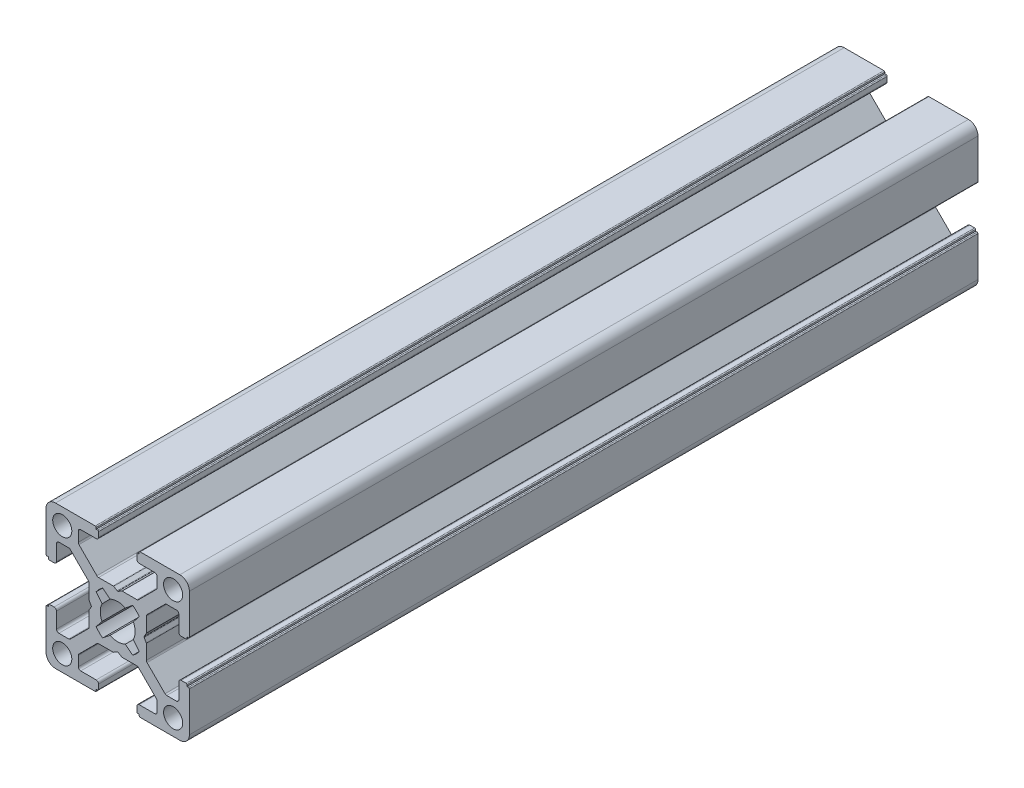
from build123d import *

# Parameters (mm, degrees)
CROQUIS1_R              = 2
SALIENTE_EXTRUIR1_DEPTH = 165


with BuildPart() as part:
    # Croquis1 → Saliente-Extruir1 (new body)
    with BuildSketch(Plane.XY.offset(1000)):
        with BuildLine():
            Line((9.800000436, -10.500000436), (10.100000436, -10.500000436))
            ThreePointArc((10.100000436, -10.500000436), (10.241421792, -10.441421792), (10.300000436, -10.300000436))
            Line((10.300000436, -10.300000436), (10.300000436, -2))
            ThreePointArc((10.300000436, -2), (9.714213998, -0.585786438), (8.300000436, 0))
            Line((8.300000436, 0), (0, 0))
            ThreePointArc((0, 0), (-0.141421356, -0.058578644), (-0.2, -0.2))
            Line((-0.2, -0.2), (-0.2, -0.5))
            Line((-0.2, -0.5), (-0.49999919, -0.5))
            ThreePointArc((-0.49999919, -0.5), (-0.641420811, -0.558578753), (-0.699999564, -0.700000374))
            Line((-0.699999564, -0.700000374), (-0.699999564, -1.700000763))
            ThreePointArc((-0.699999564, -1.700000763), (-0.553552955, -2.053554154), (-0.199999564, -2.200000763))
            Line((-0.199999564, -2.200000763), (3.050000763, -2.200000763))
            ThreePointArc((3.050000763, -2.200000763), (3.403554154, -2.346447372), (3.550000763, -2.700000763))
            Line((3.550000763, -2.700000763), (3.550000763, -4.743055509))
            ThreePointArc((3.550000763, -4.743055509), (3.511993279, -4.934269826), (3.403749103, -5.096413843))
            Line((3.403749103, -5.096413843), (-0.349053376, -8.853358334))
            ThreePointArc((-0.349053376, -8.853358334), (-0.511332616, -8.961886981), (-0.702801716, -9))
            Line((-0.702801716, -9), (-3.746809419, -9))
            ThreePointArc((-3.746809419, -9), (-3.798212795, -9.006718618), (-3.846162576, -9.026423071))
            Line((-3.846162576, -9.026423071), (-4.600646407, -9.458279719))
            ThreePointArc((-4.600646407, -9.458279719), (-4.699999564, -9.48470279), (-4.799352721, -9.458279719))
            Line((-4.799352721, -9.458279719), (-5.553836552, -9.026423071))
            ThreePointArc((-5.553836552, -9.026423071), (-5.601786333, -9.006718618), (-5.653189709, -9))
            Line((-5.653189709, -9), (-8.697197412, -9))
            ThreePointArc((-8.697197412, -9), (-8.888666513, -8.961886981), (-9.050945752, -8.853358334))
            Line((-9.050945752, -8.853358334), (-12.803748231, -5.096413843))
            ThreePointArc((-12.803748231, -5.096413843), (-12.911992407, -4.934269826), (-12.949999891, -4.743055509))
            Line((-12.949999891, -4.743055509), (-12.949999891, -2.700000763))
            ThreePointArc((-12.949999891, -2.700000763), (-12.803553282, -2.346447372), (-12.449999891, -2.200000763))
            Line((-12.449999891, -2.200000763), (-9.199999564, -2.200000763))
            ThreePointArc((-9.199999564, -2.200000763), (-8.846446173, -2.053554154), (-8.699999564, -1.700000763))
            Line((-8.699999564, -1.700000763), (-8.699999564, -0.700000374))
            ThreePointArc((-8.699999564, -0.700000374), (-8.758578317, -0.558578753), (-8.899999938, -0.5))
            Line((-8.899999938, -0.5), (-9.199999128, -0.5))
            Line((-9.199999128, -0.5), (-9.199999128, -0.2))
            ThreePointArc((-9.199999128, -0.2), (-9.258577772, -0.058578644), (-9.399999128, 0))
            Line((-9.399999128, 0), (-17.699999564, 0))
            ThreePointArc((-17.699999564, 0), (-19.114213126, -0.585786438), (-19.699999564, -2))
            Line((-19.699999564, -2), (-19.699999564, -10.300000436))
            ThreePointArc((-19.699999564, -10.300000436), (-19.64142092, -10.441421792), (-19.499999564, -10.500000436))
            Line((-19.499999564, -10.500000436), (-19.199999564, -10.500000436))
            Line((-19.199999564, -10.500000436), (-19.199999564, -10.799999627))
            ThreePointArc((-19.199999564, -10.799999627), (-19.141420811, -10.941421247), (-18.99999919, -11))
            Line((-18.99999919, -11), (-17.999998801, -11))
            ThreePointArc((-17.999998801, -11), (-17.64644541, -10.853553391), (-17.499998801, -10.5))
            Line((-17.499998801, -10.5), (-17.499998801, -7.249999673))
            ThreePointArc((-17.499998801, -7.249999673), (-17.353552192, -6.896446283), (-16.999998801, -6.749999673))
            Line((-16.999998801, -6.749999673), (-14.956944055, -6.749999673))
            ThreePointArc((-14.956944055, -6.749999673), (-14.765729738, -6.788007157), (-14.603585721, -6.896251334))
            Line((-14.603585721, -6.896251334), (-10.84664123, -10.649053813))
            ThreePointArc((-10.84664123, -10.649053813), (-10.738112583, -10.811333052), (-10.699999564, -11.002802152))
            Line((-10.699999564, -11.002802152), (-10.699999564, -14.046809855))
            ThreePointArc((-10.699999564, -14.046809855), (-10.693280947, -14.098213232), (-10.673576493, -14.146163012))
            Line((-10.673576493, -14.146163012), (-10.241719845, -14.900646843))
            ThreePointArc((-10.241719845, -14.900646843), (-10.215296774, -15), (-10.241719845, -15.099353157))
            Line((-10.241719845, -15.099353157), (-10.673576493, -15.853836988))
            ThreePointArc((-10.673576493, -15.853836988), (-10.693280947, -15.901786769), (-10.699999564, -15.953190146))
            Line((-10.699999564, -15.953190146), (-10.699999564, -18.997197848))
            ThreePointArc((-10.699999564, -18.997197848), (-10.738112583, -19.188666949), (-10.84664123, -19.350946188))
            Line((-10.84664123, -19.350946188), (-14.603585721, -23.103748667))
            ThreePointArc((-14.603585721, -23.103748667), (-14.765729738, -23.211992843), (-14.956944055, -23.250000327))
            Line((-14.956944055, -23.250000327), (-16.999998801, -23.250000327))
            ThreePointArc((-16.999998801, -23.250000327), (-17.353552192, -23.103553718), (-17.499998801, -22.750000327))
            Line((-17.499998801, -22.750000327), (-17.499998801, -19.5))
            ThreePointArc((-17.499998801, -19.5), (-17.64644541, -19.14644661), (-17.999998801, -19))
            Line((-17.999998801, -19), (-18.99999919, -19))
            ThreePointArc((-18.99999919, -19), (-19.141420811, -19.058578753), (-19.199999564, -19.200000374))
            Line((-19.199999564, -19.200000374), (-19.199999564, -19.499999564))
            Line((-19.199999564, -19.499999564), (-19.499999564, -19.499999564))
            ThreePointArc((-19.499999564, -19.499999564), (-19.64142092, -19.558578208), (-19.699999564, -19.699999564))
            Line((-19.699999564, -19.699999564), (-19.699999564, -28))
            ThreePointArc((-19.699999564, -28), (-19.114213126, -29.414213563), (-17.699999564, -30))
            Line((-17.699999564, -30), (-9.399999128, -30))
            ThreePointArc((-9.399999128, -30), (-9.258577772, -29.941421356), (-9.199999128, -29.8))
            Line((-9.199999128, -29.8), (-9.199999128, -29.5))
            Line((-9.199999128, -29.5), (-8.899999938, -29.5))
            ThreePointArc((-8.899999938, -29.5), (-8.758578317, -29.441421247), (-8.699999564, -29.299999627))
            Line((-8.699999564, -29.299999627), (-8.699999564, -28.299999237))
            ThreePointArc((-8.699999564, -28.299999237), (-8.846446173, -27.946445847), (-9.199999564, -27.799999237))
            Line((-9.199999564, -27.799999237), (-12.449999891, -27.799999237))
            ThreePointArc((-12.449999891, -27.799999237), (-12.803553282, -27.653552628), (-12.949999891, -27.299999237))
            Line((-12.949999891, -27.299999237), (-12.949999891, -25.256944491))
            ThreePointArc((-12.949999891, -25.256944491), (-12.911992407, -25.065730174), (-12.803748231, -24.903586157))
            Line((-12.803748231, -24.903586157), (-9.050945752, -21.146641666))
            ThreePointArc((-9.050945752, -21.146641666), (-8.888666513, -21.038113019), (-8.697197412, -21))
            Line((-8.697197412, -21), (-5.653189709, -21))
            ThreePointArc((-5.653189709, -21), (-5.601786333, -20.993281383), (-5.553836552, -20.973576929))
            Line((-5.553836552, -20.973576929), (-4.799352721, -20.541720281))
            ThreePointArc((-4.799352721, -20.541720281), (-4.699999564, -20.51529721), (-4.600646407, -20.541720281))
            Line((-4.600646407, -20.541720281), (-3.846162576, -20.973576929))
            ThreePointArc((-3.846162576, -20.973576929), (-3.798212795, -20.993281383), (-3.746809419, -21))
            Line((-3.746809419, -21), (-0.702801716, -21))
            ThreePointArc((-0.702801716, -21), (-0.511332616, -21.038113019), (-0.349053377, -21.146641666))
            Line((-0.349053377, -21.146641666), (3.403749103, -24.903586157))
            ThreePointArc((3.403749103, -24.903586157), (3.511993279, -25.065730174), (3.550000763, -25.256944491))
            Line((3.550000763, -25.256944491), (3.550000763, -27.299999237))
            ThreePointArc((3.550000763, -27.299999237), (3.403554154, -27.653552628), (3.050000763, -27.799999237))
            Line((3.050000763, -27.799999237), (-0.199999564, -27.799999237))
            ThreePointArc((-0.199999564, -27.799999237), (-0.553552955, -27.946445847), (-0.699999564, -28.299999237))
            Line((-0.699999564, -28.299999237), (-0.699999564, -29.299999627))
            ThreePointArc((-0.699999564, -29.299999627), (-0.641420811, -29.441421247), (-0.49999919, -29.5))
            Line((-0.49999919, -29.5), (-0.2, -29.5))
            Line((-0.2, -29.5), (-0.2, -29.8))
            ThreePointArc((-0.2, -29.8), (-0.141421356, -29.941421356), (0, -30))
            Line((0, -30), (8.300000436, -30))
            ThreePointArc((8.300000436, -30), (9.714213998, -29.414213563), (10.300000436, -28))
            Line((10.300000436, -28), (10.300000436, -19.699999564))
            ThreePointArc((10.300000436, -19.699999564), (10.241421792, -19.558578208), (10.100000436, -19.499999564))
            Line((10.100000436, -19.499999564), (9.800000436, -19.499999564))
            Line((9.800000436, -19.499999564), (9.800000436, -19.200000374))
            ThreePointArc((9.800000436, -19.200000374), (9.741421683, -19.058578753), (9.600000062, -19))
            Line((9.600000062, -19), (8.599999673, -19))
            ThreePointArc((8.599999673, -19), (8.246446283, -19.14644661), (8.099999673, -19.5))
            Line((8.099999673, -19.5), (8.099999673, -22.750000327))
            ThreePointArc((8.099999673, -22.750000327), (7.953553064, -23.103553718), (7.599999673, -23.250000327))
            Line((7.599999673, -23.250000327), (5.556944927, -23.250000327))
            ThreePointArc((5.556944927, -23.250000327), (5.36573061, -23.211992843), (5.203586593, -23.103748667))
            Line((5.203586593, -23.103748667), (1.446642102, -19.350946188))
            ThreePointArc((1.446642102, -19.350946188), (1.338113455, -19.188666949), (1.300000436, -18.997197848))
            Line((1.300000436, -18.997197848), (1.300000436, -15.953190145))
            ThreePointArc((1.300000436, -15.953190145), (1.293281819, -15.901786769), (1.273577365, -15.853836988))
            Line((1.273577365, -15.853836988), (0.841720717, -15.099353157))
            ThreePointArc((0.841720717, -15.099353157), (0.815297646, -15), (0.841720717, -14.900646843))
            Line((0.841720717, -14.900646843), (1.273577365, -14.146163012))
            ThreePointArc((1.273577365, -14.146163012), (1.293281819, -14.098213231), (1.300000436, -14.046809855))
            Line((1.300000436, -14.046809855), (1.300000436, -11.002802152))
            ThreePointArc((1.300000436, -11.002802152), (1.338113455, -10.811333052), (1.446642102, -10.649053813))
            Line((1.446642102, -10.649053813), (5.203586593, -6.896251334))
            ThreePointArc((5.203586593, -6.896251334), (5.36573061, -6.788007157), (5.556944927, -6.749999673))
            Line((5.556944927, -6.749999673), (7.599999673, -6.749999673))
            ThreePointArc((7.599999673, -6.749999673), (7.953553064, -6.896446283), (8.099999673, -7.249999673))
            Line((8.099999673, -7.249999673), (8.099999673, -10.5))
            ThreePointArc((8.099999673, -10.5), (8.246446283, -10.853553391), (8.599999673, -11))
            Line((8.599999673, -11), (9.600000062, -11))
            ThreePointArc((9.600000062, -11), (9.741421683, -10.941421247), (9.800000436, -10.799999627))
            Line((9.800000436, -10.799999627), (9.800000436, -10.500000436))
        make_face()
        with Locations((-16.300000272, -3.399999983)):
            Circle(CROQUIS1_R, mode=Mode.SUBTRACT)
        with Locations((6.900001145, -3.399999983)):
            Circle(CROQUIS1_R, mode=Mode.SUBTRACT)
        with Locations(Location((-16.300000272, -26.600000017, 0), (0, 0, 180))):
            Circle(CROQUIS1_R, mode=Mode.SUBTRACT)
        with Locations(Location((6.900001145, -26.600000017, 0), (0, 0, 180))):
            Circle(CROQUIS1_R, mode=Mode.SUBTRACT)
        with BuildLine():
            Line((-7.835928976, -10.481599097), (-6.300129088, -11.719438233))
            ThreePointArc((-6.300129088, -11.719438233), (-4.699999564, -11.35), (-3.09987004, -11.719438233))
            Line((-3.09987004, -11.719438233), (-1.564070152, -10.481599097))
            ThreePointArc((-1.564070152, -10.481599097), (-0.818997305, -11.10284444), (-0.194662672, -11.845330527))
            Line((-0.194662672, -11.845330527), (-1.419437832, -13.399870404))
            ThreePointArc((-1.419437832, -13.399870404), (-1.049999564, -15), (-1.419437832, -16.600129597))
            Line((-1.419437832, -16.600129597), (-0.194662672, -18.154669473))
            ThreePointArc((-0.194662672, -18.154669473), (-0.818997305, -18.897155561), (-1.564070152, -19.518400903))
            Line((-1.564070152, -19.518400903), (-3.09987004, -18.280561767))
            ThreePointArc((-3.09987004, -18.280561767), (-4.699999564, -18.65), (-6.300129088, -18.280561767))
            Line((-6.300129088, -18.280561767), (-7.835928976, -19.518400903))
            ThreePointArc((-7.835928976, -19.518400903), (-8.581001823, -18.897155561), (-9.205336456, -18.154669473))
            Line((-9.205336456, -18.154669473), (-7.980561295, -16.600129597))
            ThreePointArc((-7.980561295, -16.600129597), (-8.349999564, -15), (-7.980561296, -13.399870404))
            Line((-7.980561296, -13.399870404), (-9.205336456, -11.845330527))
            ThreePointArc((-9.205336456, -11.845330527), (-8.581001823, -11.10284444), (-7.835928976, -10.481599097))
        make_face(mode=Mode.SUBTRACT)
    extrude(amount=-SALIENTE_EXTRUIR1_DEPTH)


solid = part.part
